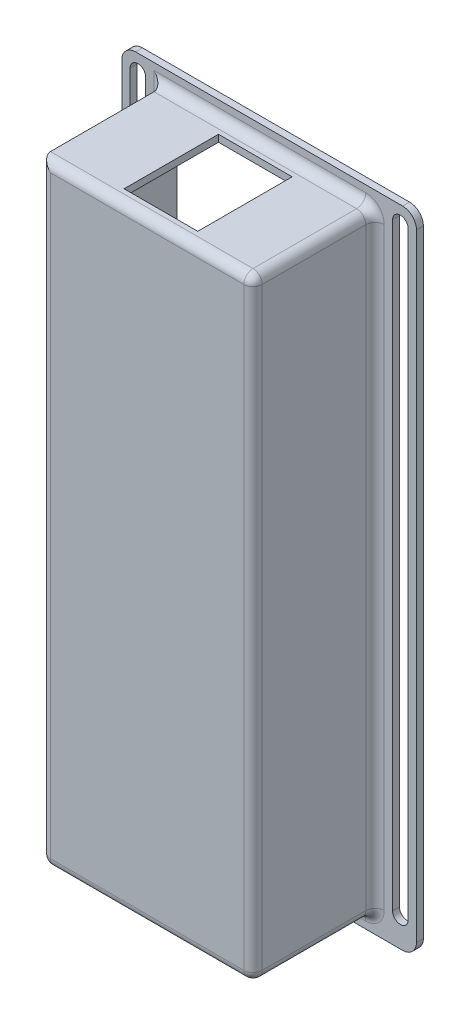
from build123d import *

# Parameters (mm, degrees)
BOSS_EXTRUDE1_DEPTH = 1.5
SKETCH2_W           = 46
SKETCH2_H           = 133
BOSS_EXTRUDE2_DEPTH = 26.5
SKETCH3_W           = 43
SKETCH3_H           = 130
CUT_EXTRUDE1_DEPTH  = 26.5
CUT_EXTRUDE2_DEPTH  = 1.5
SKETCH5_W           = 16
SKETCH5_H           = 20.5
CUT_EXTRUDE3_DEPTH  = 1.5
FILLET1_R           = 2


with BuildPart() as part:
    # Sketch1 → Boss-Extrude1 (new body)
    with BuildSketch(Plane.XY):
        with BuildLine():
            Line((-29, 70), (29, 70))
            ThreePointArc((29, 70), (31.121320344, 69.121320344), (32, 67))
            Line((32, 67), (32, -67))
            ThreePointArc((32, -67), (31.121320344, -69.121320344), (29, -70))
            Line((29, -70), (-29, -70))
            ThreePointArc((-29, -70), (-31.121320344, -69.121320344), (-32, -67))
            Line((-32, -67), (-32, 67))
            ThreePointArc((-32, 67), (-31.121320344, 69.121320344), (-29, 70))
        make_face()
    extrude(amount=BOSS_EXTRUDE1_DEPTH)

    # Sketch2 → Boss-Extrude2 (add)
    with BuildSketch(Plane.XY.offset(1.5)):
        Rectangle(SKETCH2_W, SKETCH2_H)
    extrude(amount=BOSS_EXTRUDE2_DEPTH)

    # Sketch3 → Cut-Extrude1 (cut)
    with BuildSketch(Plane(origin=(0, 0, 0), x_dir=(-1, 0, 0), z_dir=(0, 0, -1))):
        Rectangle(SKETCH3_W, SKETCH3_H)
    extrude(amount=-CUT_EXTRUDE1_DEPTH, mode=Mode.SUBTRACT)

    # Sketch4 → Cut-Extrude2 (cut)
    with BuildSketch(Plane(origin=(0, 0, 0), x_dir=(-1, 0, 0), z_dir=(0, 0, -1))):
        with BuildLine():
            Line((-30.2, 66.330000504), (-30.2, -63.669999496))
            ThreePointArc((-30.2, -63.669999496), (-28.5, -65.369999496), (-26.8, -63.669999496))
            Line((-26.8, -63.669999496), (-26.8, 66.330000504))
            ThreePointArc((-26.8, 66.330000504), (-28.5, 68.030000504), (-30.2, 66.330000504))
        make_face()
        with BuildLine():
            Line((30.2, 66.330000504), (30.2, -63.669999496))
            ThreePointArc((30.2, -63.669999496), (28.5, -65.369999496), (26.8, -63.669999496))
            Line((26.8, -63.669999496), (26.8, 66.330000504))
            ThreePointArc((26.8, 66.330000504), (28.5, 68.030000504), (30.2, 66.330000504))
        make_face()
    extrude(amount=-CUT_EXTRUDE2_DEPTH, mode=Mode.SUBTRACT)

    # Sketch5 → Cut-Extrude3 (cut)
    with BuildSketch(Plane(origin=(0, 66.5, 0), x_dir=(1, 0, 0), z_dir=(0, 1, 0))):
        with Locations((0, -14.75)):
            Rectangle(SKETCH5_W, SKETCH5_H)
    extrude(amount=-CUT_EXTRUDE3_DEPTH, mode=Mode.SUBTRACT)

    # Fillet1
    fillet1_edges = [part.edges().sort_by_distance(p)[0] for p in [
        (23, 0, 1.5),
        (23, -66.5, 14.75),
        (0, 66.5, 1.5),
        (23, 66.5, 14.75),
        (-23, 0, 1.5),
        (0, -66.5, 1.5),
        (-23, -66.5, 14.75),
        (23, 0, 28),
        (0, 66.5, 28),
        (-23, 0, 28),
        (0, -66.5, 28),
    ]]
    fillet(fillet1_edges, radius=FILLET1_R)


solid = part.part
